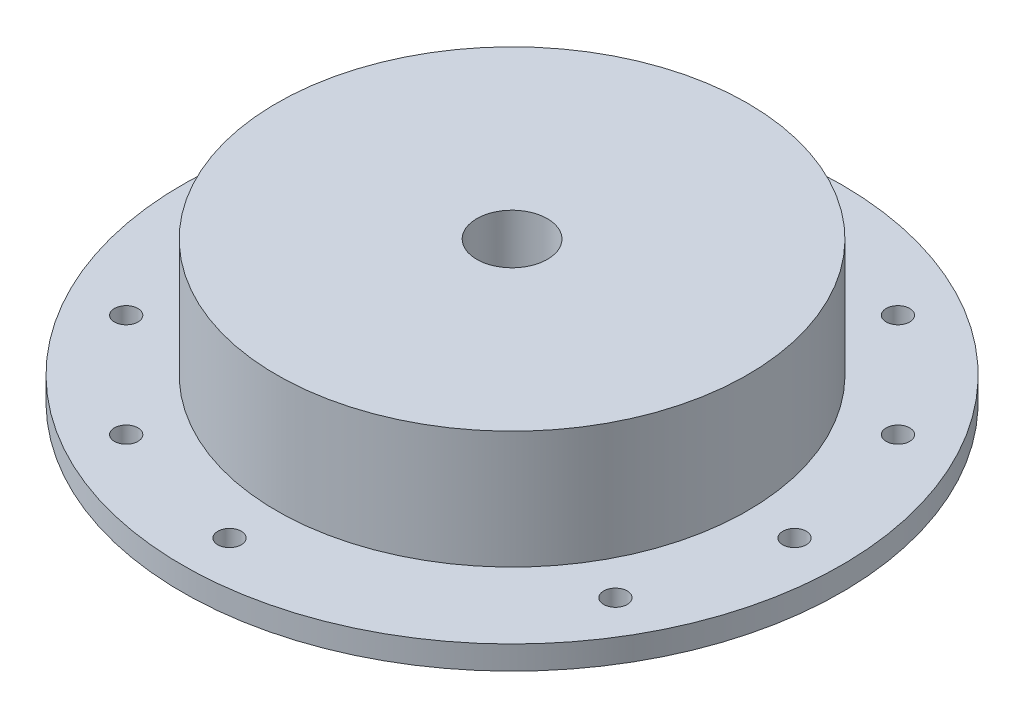
from build123d import *

# Parameters (mm, degrees)
F_1_4_0_25_DIAMETER_HOLE1_D = 6.35
CIRPATTERN2_COUNT           = 12


with BuildPart() as part:
    # Sketch1 → Revolve1 (revolve)
    with BuildSketch(Plane.XY, mode=Mode.PRIVATE) as revolve1_sk:
        with BuildLine():
            Line((9.525, 38.1), (9.525, 11.1125))
            ThreePointArc((9.525, 11.1125), (22.770141217, 2.875898843), (38.1, 0))
            Line((38.1, 0), (88.9, 0))
            Line((88.9, 0), (88.9, 6.35))
            Line((88.9, 6.35), (63.5, 6.35))
            Line((63.5, 6.35), (63.5, 38.1))
            Line((63.5, 38.1), (9.525, 38.1))
        make_face()
    revolve(revolve1_sk.sketch.rotate(Axis((0, 0, 0), (0, 1, 0)), 90), axis=Axis((0, 0, 0), (0, 1, 0)))

    # 1/4 (0.25) Diameter Hole1 (through all)
    with Locations(Plane(origin=(0, 6.35, 0), x_dir=(1, 0, 0), z_dir=(0, 1, 0))):
        with Locations((0, -76.2)):
            f_1_4_0_25_diameter_hole1 = Hole(F_1_4_0_25_DIAMETER_HOLE1_D / 2)

    # CirPattern2: 1/4 (0.25) Diameter Hole1 ×12 about axis, 1 skipped
    cirpattern2_axis = Axis((0, 0, 0), (0, 1, 0))
    add([f_1_4_0_25_diameter_hole1.rotate(cirpattern2_axis, i * 360 / CIRPATTERN2_COUNT) for i in range(1, CIRPATTERN2_COUNT) if i not in (1,)], mode=Mode.SUBTRACT)


solid = part.part
